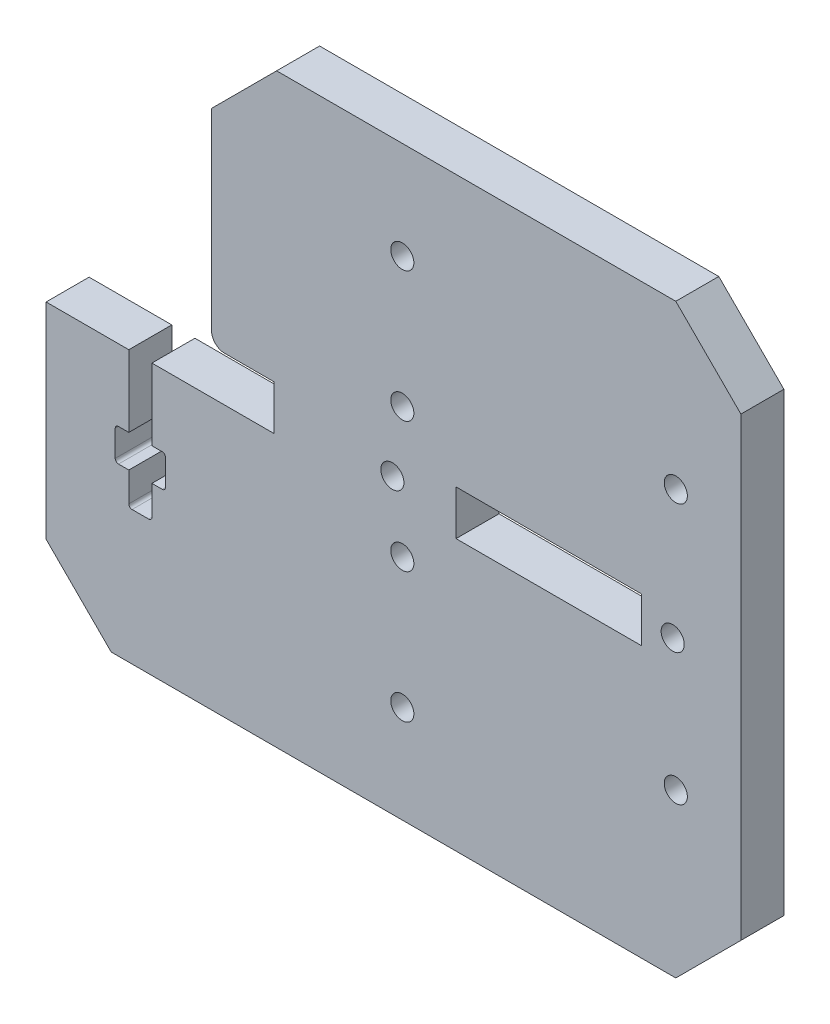
from build123d import *

# Parameters (mm, degrees)
MODEL_R             = 1.775
MODEL_W             = 28.5
MODEL_H             = 6.88
BOSS_EXTRUDE1_DEPTH = 6.6


with BuildPart() as part:
    # Model → Boss-Extrude1 (new body)
    with BuildSketch(Plane.XY):
        with BuildLine():
            Line((-40.3, 45), (-50.3, 35))
            Line((-50.3, 35), (-50.3, 5.44))
            ThreePointArc((-50.3, 5.44), (-49.714213562, 4.025786438), (-48.3, 3.44))
            Line((-48.3, 3.44), (-40.7, 3.44))
            Line((-40.7, 3.44), (-40.7, -3.44))
            Line((-40.7, -3.44), (-59.45, -3.44))
            Line((-59.45, -3.44), (-59.45, -14.44))
            Line((-59.45, -14.44), (-57.865, -14.44))
            ThreePointArc((-57.865, -14.44), (-57.511446609, -14.586446609), (-57.365, -14.94))
            Line((-57.365, -14.94), (-57.365, -18.94))
            ThreePointArc((-57.365, -18.94), (-57.511446609, -19.293553391), (-57.865, -19.44))
            Line((-57.865, -19.44), (-59.45, -19.44))
            Line((-59.45, -19.44), (-59.45, -23.94))
            ThreePointArc((-59.45, -23.94), (-59.596446609, -24.293553391), (-59.95, -24.44))
            Line((-59.95, -24.44), (-62.5, -24.44))
            ThreePointArc((-62.5, -24.44), (-62.853553391, -24.293553391), (-63, -23.94))
            Line((-63, -23.94), (-63, -19.44))
            Line((-63, -19.44), (-64.585, -19.44))
            ThreePointArc((-64.585, -19.44), (-64.938553391, -19.293553391), (-65.085, -18.94))
            Line((-65.085, -18.94), (-65.085, -14.94))
            ThreePointArc((-65.085, -14.94), (-64.938553391, -14.586446609), (-64.585, -14.44))
            Line((-64.585, -14.44), (-63, -14.44))
            Line((-63, -14.44), (-63, -3.44))
            Line((-63, -3.44), (-75.7, -3.44))
            Line((-75.7, -3.44), (-75.7, -35))
            Line((-75.7, -35), (-65.7, -45))
            Line((-65.7, -45), (21, -45))
            Line((21, -45), (31, -35))
            Line((31, -35), (31, 35))
            Line((31, 35), (21, 45))
            Line((21, 45), (-40.3, 45))
        make_face()
        with Locations((-21, 30)):
            Circle(MODEL_R, mode=Mode.SUBTRACT)
        with Locations((-21, 10)):
            Circle(MODEL_R, mode=Mode.SUBTRACT)
        with Locations((-21, -10)):
            Circle(MODEL_R, mode=Mode.SUBTRACT)
        with Locations((-21, -30)):
            Circle(MODEL_R, mode=Mode.SUBTRACT)
        with Locations((21, 20)):
            Circle(MODEL_R, mode=Mode.SUBTRACT)
        with Locations((21, -20)):
            Circle(MODEL_R, mode=Mode.SUBTRACT)
        with Locations((-22.524993759, 0)):
            Circle(MODEL_R, mode=Mode.SUBTRACT)
        with Locations((20.525006241, 0)):
            Circle(MODEL_R, mode=Mode.SUBTRACT)
        with Locations((1.500006241, 0)):
            Rectangle(MODEL_W, MODEL_H, mode=Mode.SUBTRACT)
    extrude(amount=BOSS_EXTRUDE1_DEPTH)


solid = part.part
